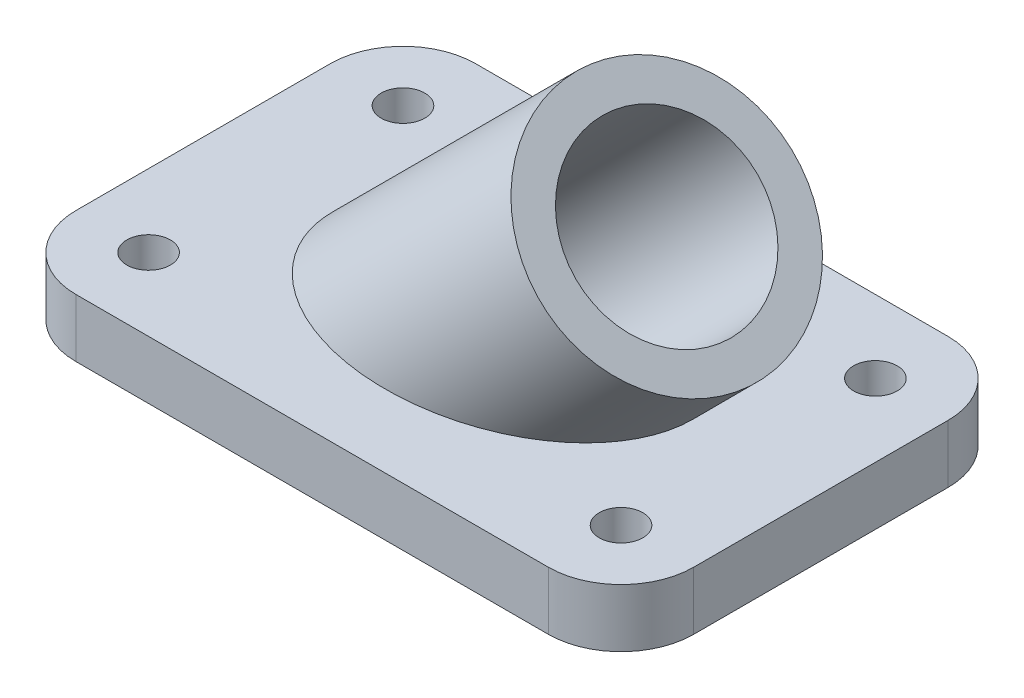
from build123d import *

# Parameters (mm, degrees)
SKETCH1_W            = 107.95
SKETCH1_H            = 69.85
BOSS_EXTRUDE1_DEPTH  = 10.16
SKETCH3_R            = 3.81
CUT_EXTRUDE1_DEPTH   = 66.086725605
LPATTERN1_COUNT      = 20
LPATTERN1_PITCH      = 82.55
LPATTERN1_COUNT_DIR2 = 2
LPATTERN1_PITCH_DIR2 = 44.45
FILLET1_R            = 12.7
BOSS_EXTRUDE2_REACH  = 100.241
SKETCH4_R            = 22.225
SKETCH5_R            = 15.875
CUT_EXTRUDE2_DEPTH   = 99.241498296


with BuildPart() as part:
    # Sketch1 → Boss-Extrude1 (new body)
    with BuildSketch(Plane(origin=(0, 0, 0), x_dir=(1, 0, 0), z_dir=(0, 1, 0))):
        Rectangle(SKETCH1_W, SKETCH1_H)
    extrude(amount=BOSS_EXTRUDE1_DEPTH)

    # Sketch3 → Cut-Extrude1 (cut, through all)
    with BuildSketch(Plane(origin=(0, 10.16, 0), x_dir=(1, 0, 0), z_dir=(0, 1, 0))):
        with Locations(Location((41.275, 22.225, 0), (0, 0, 270))):
            Circle(SKETCH3_R)
    cut_extrude1 = extrude(amount=-CUT_EXTRUDE1_DEPTH, mode=Mode.SUBTRACT)

    # LPattern1: Cut-Extrude1 20 × 2
    with Locations(*[(-i * LPATTERN1_PITCH, 0, j * LPATTERN1_PITCH_DIR2) for i in range(LPATTERN1_COUNT) for j in range(LPATTERN1_COUNT_DIR2) if (i, j) != (0, 0)]):
        add(cut_extrude1, mode=Mode.SUBTRACT)

    # Fillet1
    fillet1_edges = [part.edges().sort_by_distance(p)[0] for p in [
        (53.975, 5.08, 34.925),
        (-53.975, 5.08, 34.925),
        (-53.975, 5.08, -34.925),
        (53.975, 5.08, -34.925),
    ]]
    fillet(fillet1_edges, radius=FILLET1_R)

    # Boss-Extrude2: up to this plane
    boss_extrude2_end = Plane(origin=(0, 10.16, 0), z_dir=(0, -1, 0))
    # Sketch4 → Boss-Extrude2 (add, up to the surface)
    with BuildSketch(Plane(origin=(32.0675, 32.0675, 0), x_dir=(0, 0, -1), z_dir=(0.7071067811865488, 0.7071067811865464, 0)), mode=Mode.PRIVATE) as boss_extrude2_sk1:
        with Locations(Location((0, 7.118116382, 0), (0, 0, 90))):
            Circle(SKETCH4_R)
    boss_extrude2_tool1 = split(extrude(boss_extrude2_sk1.sketch, amount=-BOSS_EXTRUDE2_REACH, mode=Mode.PRIVATE), bisect_by=boss_extrude2_end, keep=Keep.BOTH, mode=Mode.PRIVATE)
    add(boss_extrude2_tool1.solids().sort_by_distance((27.034232, 37.100768, 0))[0])

    # Sketch5 → Cut-Extrude2 (cut, through all)
    with BuildSketch(Plane(origin=(32.0675, 32.0675, 0), x_dir=(0, 0, -1), z_dir=(0.7071067811865488, 0.7071067811865464, 0))):
        with Locations(Location((0, 7.118116382, 0), (0, 0, 90))):
            Circle(SKETCH5_R)
    extrude(amount=-CUT_EXTRUDE2_DEPTH, mode=Mode.SUBTRACT)


solid = part.part
